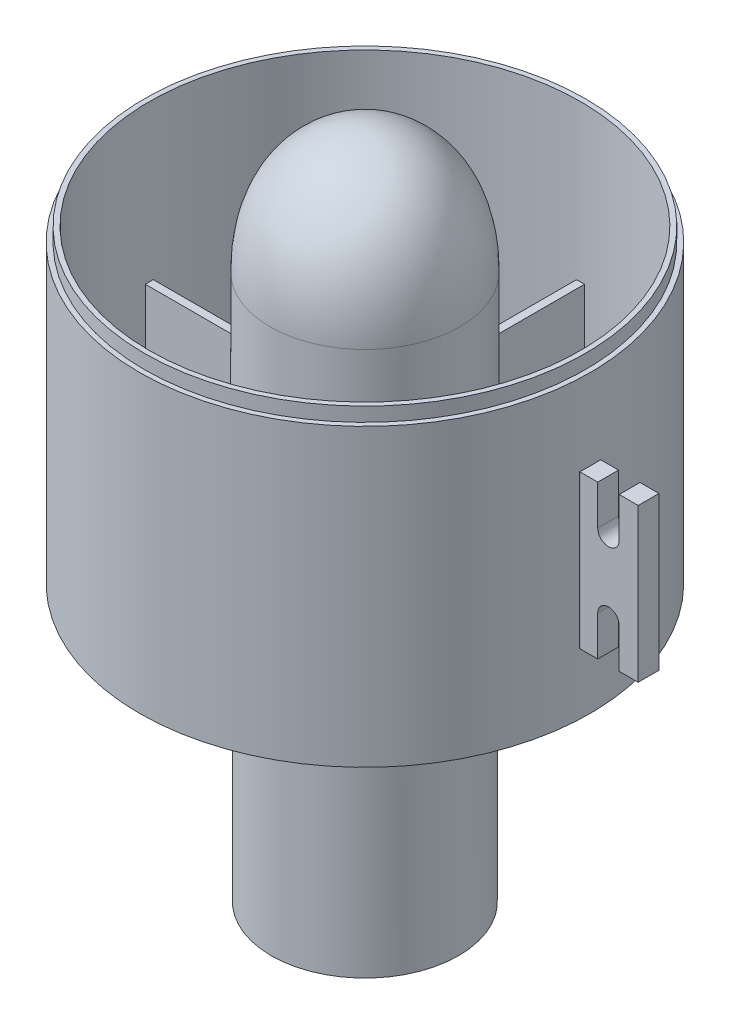
from build123d import *

# Parameters (mm, degrees)
SKETCH1_R                  = 36.8
SKETCH1_R_2                = 35.2
BOSS_EXTRUDE1_DEPTH        = 50.5
SKETCH2_R                  = 15
BOSS_EXTRUDE2_DEPTH        = 25
BOSS_EXTRUDE3_DEPTH        = 1.7
BOSS_EXTRUDE3_DEPTH_BACK   = 1.7
BOSS_EXTRUDE3_2_DEPTH      = 1.7
BOSS_EXTRUDE3_2_DEPTH_BACK = 1.7
BOSS_EXTRUDE4_REACH        = 105.973
BOSS_EXTRUDE4_END_RADIUS   = 36.8
SKETCH4_W                  = 3.4
SKETCH4_H                  = 25
CUT_EXTRUDE1_START         = -2.3
SKETCH5_R                  = 36.8
SKETCH5_R_2                = 36
CUT_EXTRUDE1_DEPTH         = 2.3
SKETCH6_R                  = 15.3
BOSS_EXTRUDE5_DEPTH        = 50
CHAMFER1_SIZE              = 5
CHAMFER1_SIZE2             = 8.660254038
SKETCH7_R                  = 15.5
BOSS_EXTRUDE6_DEPTH        = 44


with BuildPart() as part:
    # Sketch1 → Boss-Extrude1 (new body)
    with BuildSketch(Plane(origin=(0, 0, 0), x_dir=(1, 0, 0), z_dir=(0, 1, 0))):
        with Locations(Location((0, 0, 0), (0, 0, 270))):
            Circle(SKETCH1_R)
        with Locations(Location((0, 0, 0), (0, 0, 270))):
            Circle(SKETCH1_R_2, mode=Mode.SUBTRACT)
    extrude(amount=BOSS_EXTRUDE1_DEPTH)

    # Sketch2 → Boss-Extrude2 (add)
    with BuildSketch(Plane.XZ):
        with BuildLine():
            Line((15.986791423, 0.65), (35.193998068, 0.65))
            ThreePointArc((35.193998068, 0.65), (35.2, 0), (35.193998068, -0.65))
            Line((35.193998068, -0.65), (15.986791423, -0.65))
            ThreePointArc((15.986791423, -0.65), (14.78207252, -6.122934918), (11.763988032, -10.844749217))
            Line((11.763988032, -10.844749217), (25.345534099, -24.426295283))
            ThreePointArc((25.345534099, -24.426295283), (24.890158698, -24.890158698), (24.426295283, -25.345534099))
            Line((24.426295283, -25.345534099), (10.844749217, -11.763988032))
            ThreePointArc((10.844749217, -11.763988032), (6.122934918, -14.78207252), (0.65, -15.986791423))
            Line((0.65, -15.986791423), (0.65, -35.193998068))
            ThreePointArc((0.65, -35.193998068), (0, -35.2), (-0.65, -35.193998068))
            Line((-0.65, -35.193998068), (-0.65, -15.986791423))
            ThreePointArc((-0.65, -15.986791423), (-6.122934918, -14.78207252), (-10.844749217, -11.763988032))
            Line((-10.844749217, -11.763988032), (-24.426295283, -25.345534099))
            ThreePointArc((-24.426295283, -25.345534099), (-24.890158698, -24.890158698), (-25.345534099, -24.426295283))
            Line((-25.345534099, -24.426295283), (-11.763988032, -10.844749217))
            ThreePointArc((-11.763988032, -10.844749217), (-14.78207252, -6.122934918), (-15.986791423, -0.65))
            Line((-15.986791423, -0.65), (-35.193998068, -0.65))
            ThreePointArc((-35.193998068, -0.65), (-35.2, 0), (-35.193998068, 0.65))
            Line((-35.193998068, 0.65), (-15.986791423, 0.65))
            ThreePointArc((-15.986791423, 0.65), (-14.78207252, 6.122934918), (-11.763988032, 10.844749217))
            Line((-11.763988032, 10.844749217), (-25.345534099, 24.426295283))
            ThreePointArc((-25.345534099, 24.426295283), (-24.890158698, 24.890158698), (-24.426295283, 25.345534099))
            Line((-24.426295283, 25.345534099), (-10.844749217, 11.763988032))
            ThreePointArc((-10.844749217, 11.763988032), (-6.122934918, 14.78207252), (-0.65, 15.986791423))
            Line((-0.65, 15.986791423), (-0.65, 35.193998068))
            ThreePointArc((-0.65, 35.193998068), (0, 35.2), (0.65, 35.193998068))
            Line((0.65, 35.193998068), (0.65, 15.986791423))
            ThreePointArc((0.65, 15.986791423), (6.122934918, 14.78207252), (10.844749217, 11.763988032))
            Line((10.844749217, 11.763988032), (24.426295283, 25.345534099))
            ThreePointArc((24.426295283, 25.345534099), (24.890158698, 24.890158698), (25.345534099, 24.426295283))
            Line((25.345534099, 24.426295283), (11.763988032, 10.844749217))
            ThreePointArc((11.763988032, 10.844749217), (14.78207252, 6.122934918), (15.986791423, 0.65))
        make_face()
        with Locations(Location((0, 0, 0), (0, 0, 270))):
            Circle(SKETCH2_R, mode=Mode.SUBTRACT)
    extrude(amount=-BOSS_EXTRUDE2_DEPTH)

    # Boss-Extrude4: up to this cylinder (the profile starts outside it)
    boss_extrude4_end = Plane(origin=(0, 22.5, 0), z_dir=(0, -1, 0)) * Cylinder(BOSS_EXTRUDE4_END_RADIUS, 286.546, mode=Mode.PRIVATE)
    # Sketch4 → Boss-Extrude4 (add, up to the surface)
    with BuildSketch(Plane.ZY.offset(-36.800796618), mode=Mode.PRIVATE) as boss_extrude4_sk1:
        with Locations((0, 22.5)):
            Rectangle(SKETCH4_W, SKETCH4_H)
    boss_extrude4_tool1 = extrude(boss_extrude4_sk1.sketch, amount=BOSS_EXTRUDE4_REACH, mode=Mode.PRIVATE) - boss_extrude4_end
    add(boss_extrude4_tool1.solids().sort_by_distance((36.800797, 22.5, 0))[0])

    # Sketch5 → Cut-Extrude1 (cut)
    with BuildSketch(Plane(origin=(0, 50.5, 0), x_dir=(1, 0, 0), z_dir=(0, 1, 0)).offset(CUT_EXTRUDE1_START)):
        with Locations(Location((0, 0, 0), (0, 0, 270))):
            Circle(SKETCH5_R)
        with Locations(Location((0, 0, 0), (0, 0, 270))):
            Circle(SKETCH5_R_2, mode=Mode.SUBTRACT)
    extrude(amount=CUT_EXTRUDE1_DEPTH, mode=Mode.SUBTRACT)

    # Sketch6 → Boss-Extrude5 (add)
    with BuildSketch(Plane.XZ):
        with Locations(Location((0, 0, 0), (0, 0, 90))):
            Circle(SKETCH6_R)
    extrude(amount=BOSS_EXTRUDE5_DEPTH)

    # Chamfer1
    chamfer1_edges = [part.edges().sort_by_distance(p)[0] for p in [
        (0, -50, -15.3),
    ]]
    chamfer1_side = [part.faces().sort_by_distance(p)[0] for p in [
        (0, -25, -15.3),
    ]]
    chamfer(chamfer1_edges, length=CHAMFER1_SIZE, length2=CHAMFER1_SIZE2, reference=chamfer1_side[0])

    # Sketch7 → Boss-Extrude6 (add)
    with BuildSketch(Plane(origin=(0, 0, 0), x_dir=(1, 0, 0), z_dir=(0, 1, 0))):
        with Locations(Location((0, 0, 0), (0, 0, 90))):
            Circle(SKETCH7_R)
    extrude(amount=BOSS_EXTRUDE6_DEPTH)

    # Sketch8 → Revolve2 (revolve)
    with BuildSketch(Plane(origin=(0, 0, 0), x_dir=(0, -1, 0), z_dir=(0, 0, 1)), mode=Mode.PRIVATE) as revolve2_sk:
        with BuildLine():
            Line((-44, 15.5), (-44, 0))
            Line((-44, 0), (-64, 0))
            add(Edge.make_bspline(
                [(-44, 15.5), (-57.970648209, 15.5), (-64, 7.069745011), (-64, 0)],
                knots=[0, 0, 0, 0, 1, 1, 1, 1], degree=3))
        make_face()
    revolve(revolve2_sk.sketch.rotate(Axis((0, 25, 0), (0, -1, 0)), 271.058078794), axis=Axis((0, 25, 0), (0, -1, 0)))


with BuildPart() as body_2:
    # Sketch3 → Boss-Extrude3 (new, two sides: drawn at the far end of the back side and taken through both)
    with BuildSketch(Plane(origin=(0, 0, 0), x_dir=(0, -1, 0), z_dir=(0, 0, 1)).offset(-BOSS_EXTRUDE3_DEPTH_BACK)):
        with BuildLine():
            Line((-35, 36.800796618), (-10, 36.800796618))
            Line((-10, 36.800796618), (-10, 39.7))
            Line((-10, 39.7), (-16.5, 39.7))
            ThreePointArc((-16.5, 39.7), (-18.25, 41.45), (-16.5, 43.2))
            Line((-16.5, 43.2), (-10, 43.2))
            Line((-10, 43.2), (-10, 46.300796618))
            Line((-10, 46.300796618), (-35, 46.300796618))
            Line((-35, 46.300796618), (-35, 43.2))
            Line((-35, 43.2), (-28.5, 43.2))
            ThreePointArc((-28.5, 43.2), (-26.75, 41.45), (-28.5, 39.7))
            Line((-28.5, 39.7), (-35, 39.7))
            Line((-35, 39.7), (-35, 36.800796618))
        make_face()
    extrude(amount=BOSS_EXTRUDE3_DEPTH + BOSS_EXTRUDE3_DEPTH_BACK)


with BuildPart() as body_3:
    # Sketch3 → Boss-Extrude3 2 (new, two sides: drawn at the far end of the back side and taken through both)
    with BuildSketch(Plane(origin=(0, 0, 0), x_dir=(0, -1, 0), z_dir=(0, 0, 1)).offset(-BOSS_EXTRUDE3_2_DEPTH_BACK)):
        with BuildLine():
            Line((-16.5, -39.7), (-10, -39.7))
            Line((-10, -39.7), (-10, -36.800796618))
            Line((-10, -36.800796618), (-35, -36.800796618))
            Line((-35, -36.800796618), (-35, -39.7))
            Line((-35, -39.7), (-28.5, -39.7))
            ThreePointArc((-28.5, -39.7), (-26.75, -41.45), (-28.5, -43.2))
            Line((-28.5, -43.2), (-35, -43.2))
            Line((-35, -43.2), (-35, -46.300796618))
            Line((-35, -46.300796618), (-10, -46.300796618))
            Line((-10, -46.300796618), (-10, -43.2))
            Line((-10, -43.2), (-16.5, -43.2))
            ThreePointArc((-16.5, -43.2), (-18.25, -41.45), (-16.5, -39.7))
        make_face()
    extrude(amount=BOSS_EXTRUDE3_2_DEPTH + BOSS_EXTRUDE3_2_DEPTH_BACK)


solid = Compound([part.part, body_2.part, body_3.part])
